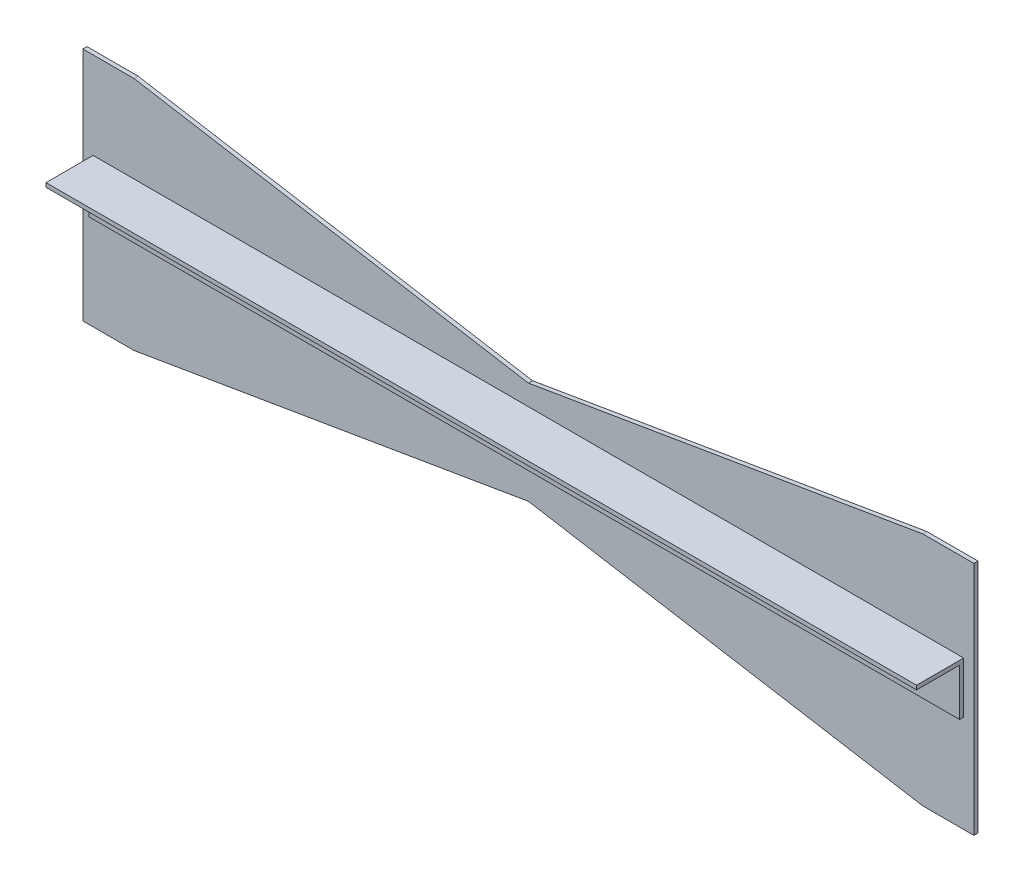
from build123d import *

# Parameters (mm, degrees)
EXTRUDE_2_DEPTH       = 8
SKETCH_5_W            = 850
SKETCH_5_H            = 100
EXTRUDE_3_DEPTH       = 8
SKETCH_6_W            = 850
SKETCH_6_H            = 8
EXTRUDE_4_DEPTH       = 84
MIRROR_7_COPY_1_DEPTH = 8


with BuildPart() as part:
    # 草图1 → 凸台-拉伸2 (new body)
    with BuildSketch(Plane.XY):
        Polygon((-870, 0), (-870, 230), (-770, 230), (0, 100), (0, 0), align=None)
    extrude_2 = extrude(amount=EXTRUDE_2_DEPTH)

    # 镜向2: 凸台-拉伸2 across plane
    add(extrude_2.mirror(Plane.ZX))

    # 草图5 → 凸台-拉伸3 (add)
    with BuildSketch(Plane.XY.offset(8)):
        with Locations((-425, 10)):
            Rectangle(SKETCH_5_W, SKETCH_5_H)
    extrude_3 = extrude(amount=EXTRUDE_3_DEPTH)

    # 草图6 → 凸台-拉伸4 (add)
    with BuildSketch(Plane.XY.offset(16)):
        with Locations((-425, 56)):
            Rectangle(SKETCH_6_W, SKETCH_6_H)
    extrude_4 = extrude(amount=EXTRUDE_4_DEPTH)

    # 镜向7: 凸台-拉伸2, 凸台-拉伸3, 凸台-拉伸4 across plane
    add(extrude_2.mirror(Plane(origin=(0, 0, 0), x_dir=(0, 0, 1), z_dir=(1, 0, 0))))
    add(extrude_3.mirror(Plane(origin=(0, 0, 0), x_dir=(0, 0, 1), z_dir=(1, 0, 0))))
    add(extrude_4.mirror(Plane(origin=(0, 0, 0), x_dir=(0, 0, 1), z_dir=(1, 0, 0))))

    # 镜向7 copy 1 sketch → 镜向7 copy 1 (add)
    with BuildSketch(Plane(origin=(0, 0, 0), x_dir=(-1, 0, 0), z_dir=(0, 0, 1))):
        Polygon((-870, 0), (-870, 230), (-770, 230), (0, 100), (0, 0), align=None)
    extrude(amount=MIRROR_7_COPY_1_DEPTH)


solid = part.part
